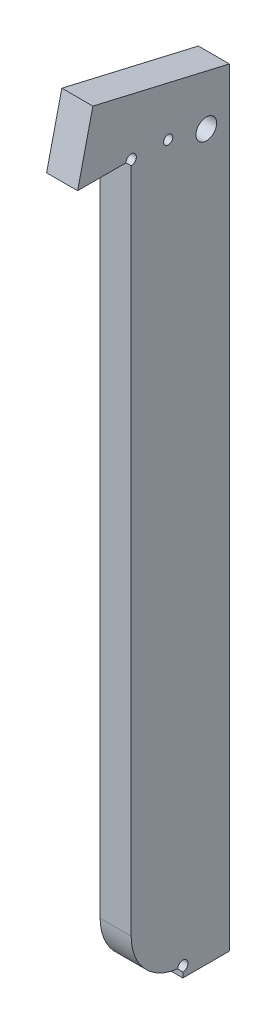
from build123d import *

# Parameters (mm, degrees)
SKETCH1_W                                        = 19.05
SKETCH1_H                                        = 450.85
BOSS_EXTRUDE1_DEPTH                              = 66.675
FILLET4_R                                        = 38.1
CUT_EXTRUDE1_REACH                               = 458.151
BOSS_EXTRUDE2_DEPTH                              = 19.05
BOSS_EXTRUDE3_DEPTH                              = 19.05
F_1_4_0_25_DIAMETER_HOLE1_D                      = 6.35
F_10_CLEARANCE_HOLE_WITH_1_0_X_25_CB_D           = 5.6134
F_10_CLEARANCE_HOLE_WITH_1_0_X_25_CB_CBORE_D     = 12.7
F_10_CLEARANCE_HOLE_WITH_1_0_X_25_CB_CBORE_DEPTH = 6.35
F_1_2_0_5_DIAMETER_SLOT1_D                       = 12.7


with BuildPart() as part:
    # Sketch1 → Boss-Extrude1 (new body)
    with BuildSketch(Plane.XY):
        with Locations((-218.563766336, -225.425)):
            Rectangle(SKETCH1_W, SKETCH1_H)
    extrude(amount=BOSS_EXTRUDE1_DEPTH)

    # Fillet4
    fillet4_edges = [part.edges().sort_by_distance(p)[0] for p in [
        (-218.563766336, -450.85, 66.675),
    ]]
    fillet(fillet4_edges, radius=FILLET4_R)

    # Sketch4 → Cut-Extrude1 (cut, up to next)
    with BuildSketch(Plane.ZY.offset(228.088766336), mode=Mode.PRIVATE) as cut_extrude1_sk1:
        with BuildLine():
            Line((66.675, 0), (66.675, -412.75))
            ThreePointArc((66.675, -412.75), (55.515768363, -439.690768363), (28.575, -450.85))
            Line((28.575, -450.85), (28.575, -444.5))
            ThreePointArc((28.575, -444.5), (51.025640303, -435.200640303), (60.325, -412.75))
            Line((60.325, -412.75), (60.325, 0))
            Line((60.325, 0), (66.675, 0))
        make_face()
    cut_extrude1_tool1 = extrude(cut_extrude1_sk1.sketch, amount=-CUT_EXTRUDE1_REACH, mode=Mode.PRIVATE) & part.part
    add(cut_extrude1_tool1.solids().sort_by_distance((-228.088766, -233.202612, 62.01827))[0], mode=Mode.SUBTRACT)

    # Sketch7 → Boss-Extrude2 (add, through all)
    with BuildSketch(Plane.ZY.offset(228.088766336)):
        Polygon((0, 0), (60.325, 0), (60.325, 34.844553242), (0, 20.824633003), align=None)
    extrude(amount=-BOSS_EXTRUDE2_DEPTH)

    # Sketch8 → Boss-Extrude3 (add, through all)
    with BuildSketch(Plane.ZY.offset(228.088766336)):
        Polygon((60.325, 34.844553242), (83.828599938, 40.306941911), (93.196193981, 0), (60.325, 0), align=None)
    extrude(amount=-BOSS_EXTRUDE3_DEPTH)

    # 1/4 (0.25) Diameter Hole1 (through all)
    with Locations(Plane.ZY.offset(228.088766336)):
        with Locations((28.575, -444.5), (60.325, 0)):
            Hole(F_1_4_0_25_DIAMETER_HOLE1_D / 2)

    # #10 Clearance Hole with 1.0 x .25 CB (through all)
    with Locations(Plane.ZY.offset(228.088766336)):
        with Locations((37.58012522, -0.660555349)):
            CounterBoreHole(F_10_CLEARANCE_HOLE_WITH_1_0_X_25_CB_D / 2, F_10_CLEARANCE_HOLE_WITH_1_0_X_25_CB_CBORE_D / 2, F_10_CLEARANCE_HOLE_WITH_1_0_X_25_CB_CBORE_DEPTH)

    # 1/2 (0.5) Diameter Slot1 (through all)
    with Locations(Plane.ZY.offset(228.088766336)):
        with Locations((14.175520603, -6.646762989)):
            Hole(F_1_2_0_5_DIAMETER_SLOT1_D / 2)


solid = part.part
